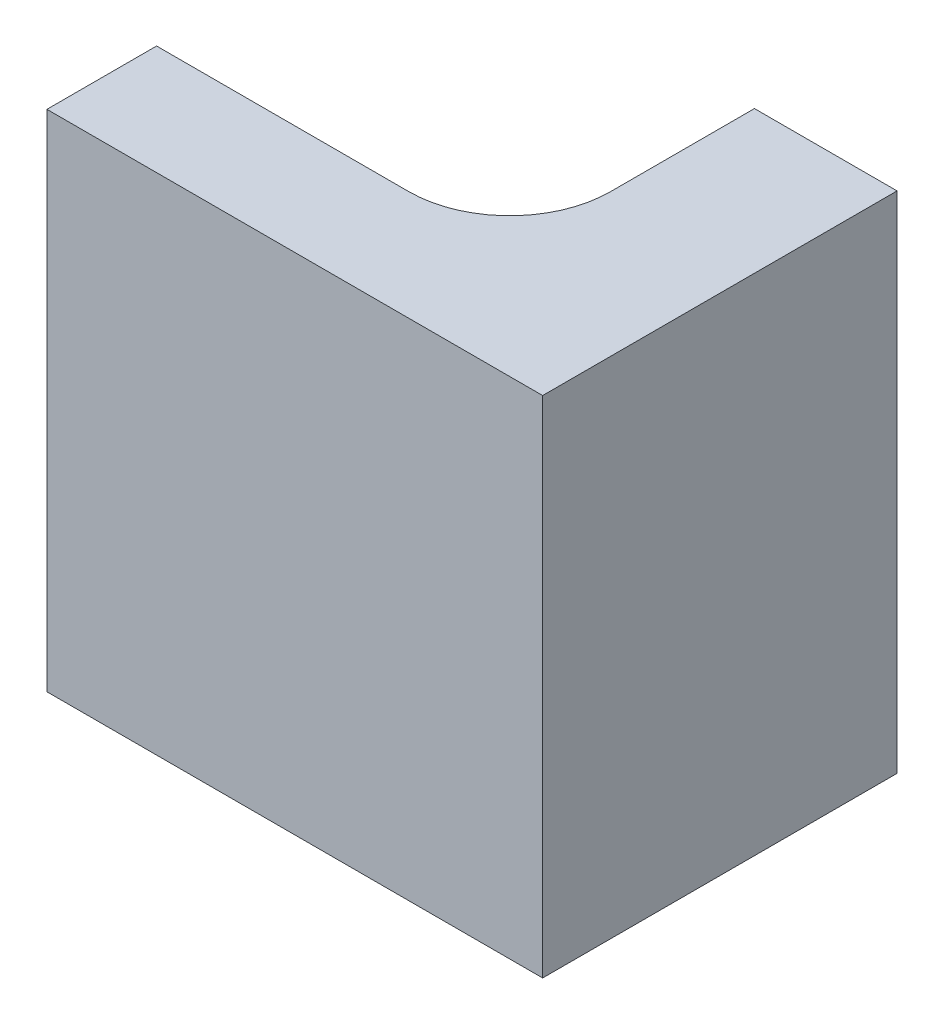
from build123d import *

# Parameters (mm, degrees)
BOSS_EXTRUDE1_DEPTH = 50
VARFILLET1_R        = 10


with BuildPart() as part:
    # Sketch1 → Boss-Extrude1 (new body)
    with BuildSketch(Plane(origin=(0, 0, 0), x_dir=(1, 0, 0), z_dir=(0, 1, 0))):
        Polygon((0, 0), (49.1370117, 0), (49.1370117, 35.13023464), (35, 35.13023464), (35, 10.869893229), (0, 10.869893229), align=None)
    extrude(amount=BOSS_EXTRUDE1_DEPTH)

    # VarFillet1
    varfillet1_edges = [part.edges().sort_by_distance(p)[0] for p in [
        (35, 25, -10.869893229),
    ]]
    fillet(varfillet1_edges, radius=VARFILLET1_R)


solid = part.part
